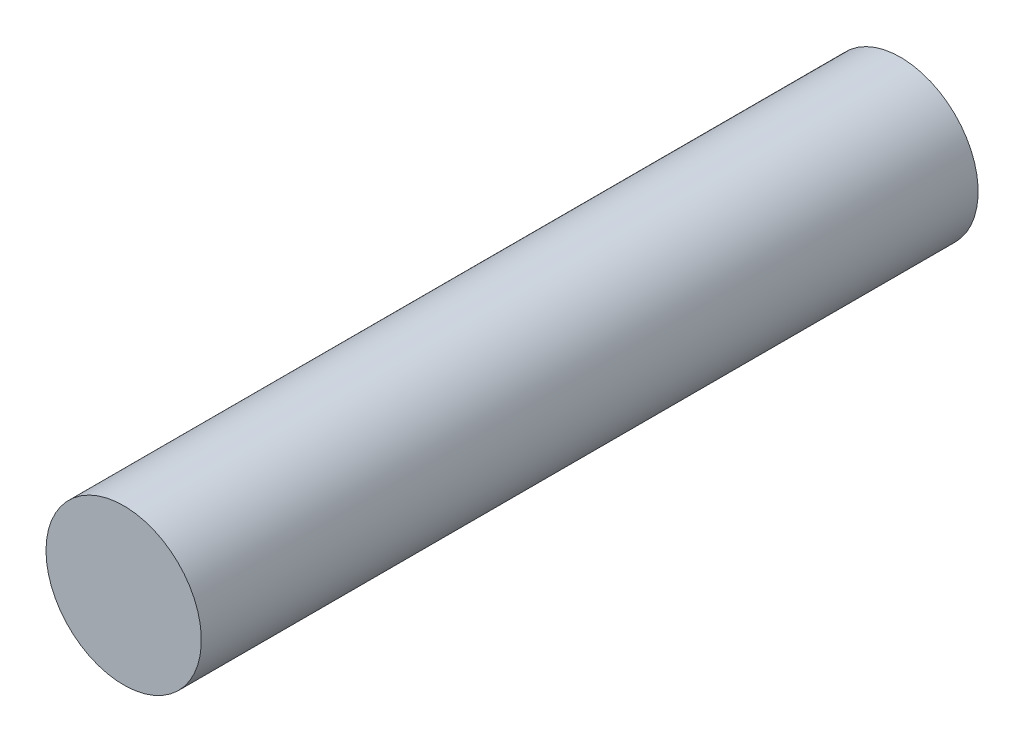
from build123d import *

# Parameters (mm, degrees)
SKETCH2_R           = 7.62
BOSS_EXTRUDE1_DEPTH = 76.2


with BuildPart() as part:
    # Sketch2 → Boss-Extrude1 (new body)
    with BuildSketch(Plane.XY):
        with Locations(Location((0, 0, 0), (0, 0, 180))):
            Circle(SKETCH2_R)
    extrude(amount=BOSS_EXTRUDE1_DEPTH)


solid = part.part
